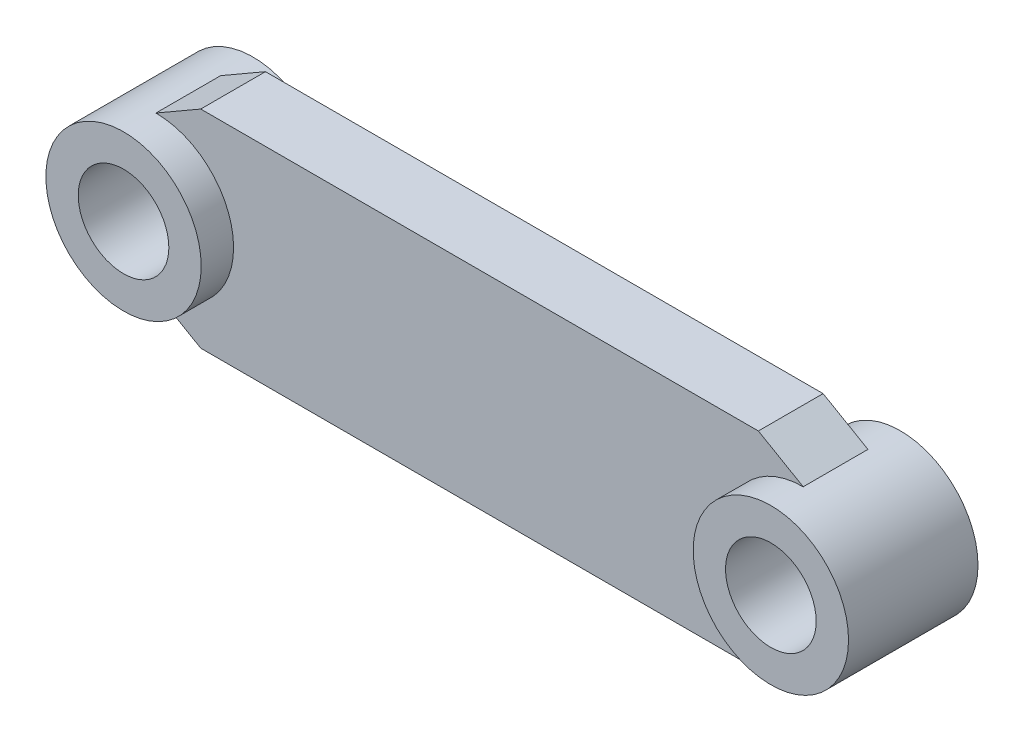
from build123d import *

# Parameters (mm, degrees)
SKETCH1_R           = 6
SKETCH1_R_2         = 3.5
BOSS_EXTRUDE1_DEPTH = 2.5
SKETCH4_R           = 6
SKETCH4_R_2         = 3.5
BOSS_EXTRUDE2_DEPTH = 5


with BuildPart() as part:
    # Sketch1 → Boss-Extrude1 (new, symmetric)
    # profile 1 of 3: a face of its own
    with BuildSketch(Plane.XY):
        with BuildLine():
            Line((3.464101615, 8), (0, 6))
            ThreePointArc((0, 6), (4.242640687, 4.242640687), (6, 0))
            ThreePointArc((6, 0), (4.242640687, -4.242640687), (0, -6))
            Line((0, -6), (3.464101615, -8))
            Line((3.464101615, -8), (46.535898385, -8))
            Line((46.535898385, -8), (50, -6))
            ThreePointArc((50, -6), (44, 0), (50, 6))
            Line((50, 6), (46.535898385, 8))
            Line((46.535898385, 8), (3.464101615, 8))
        make_face()
    # profile 2 of 3: a face of its own
    with BuildSketch(Plane.XY):
        Circle(SKETCH1_R)
        Circle(SKETCH1_R_2, mode=Mode.SUBTRACT)
    # profile 3 of 3: a face of its own
    with BuildSketch(Plane.XY):
        with Locations((50, 0)):
            Circle(SKETCH1_R)
        with Locations((50, 0)):
            Circle(SKETCH1_R_2, mode=Mode.SUBTRACT)
    extrude(amount=BOSS_EXTRUDE1_DEPTH, both=True)

    # Sketch4 → Boss-Extrude2 (add, symmetric)
    # profile 1 of 2: a face of its own
    with BuildSketch(Plane.XY):
        Circle(SKETCH4_R)
        Circle(SKETCH4_R_2, mode=Mode.SUBTRACT)
    # profile 2 of 2: a face of its own
    with BuildSketch(Plane.XY):
        with Locations((50, 0)):
            Circle(SKETCH4_R)
        with Locations((50, 0)):
            Circle(SKETCH4_R_2, mode=Mode.SUBTRACT)
    extrude(amount=BOSS_EXTRUDE2_DEPTH, both=True)


solid = part.part
